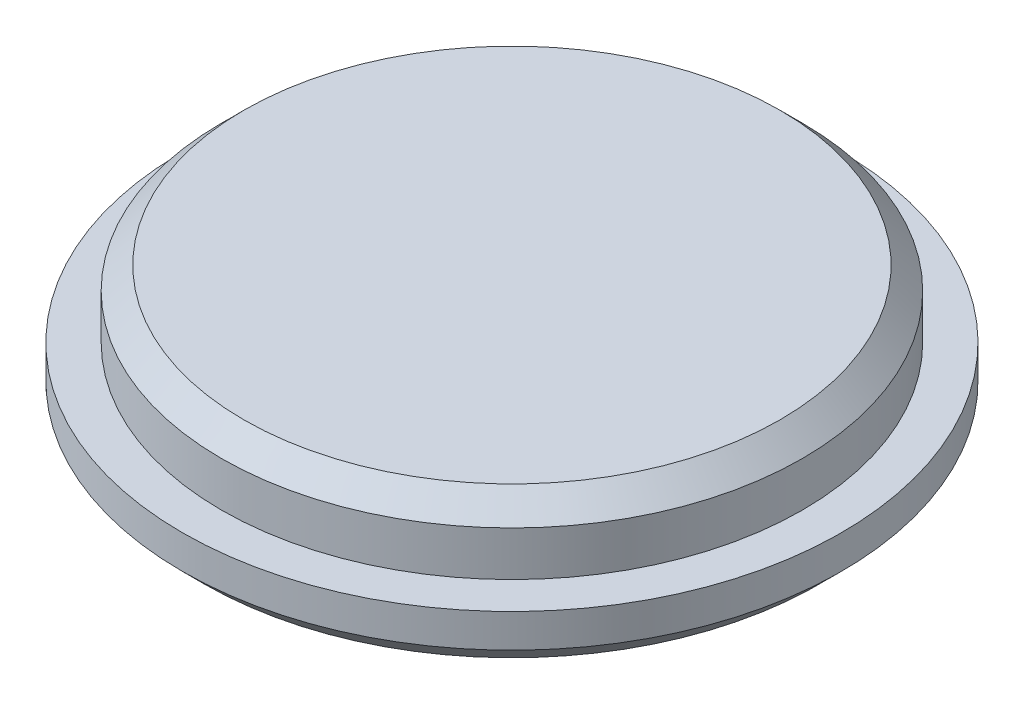
from build123d import *


with BuildPart() as part:
    # Sketch2 → Revolve1 (revolve)
    with BuildSketch(Plane.XY, mode=Mode.PRIVATE) as revolve1_sk:
        Polygon((0, 0), (27.5, 0), (29.5, 2), (29.5, 5), (26, 5), (26, 9), (24, 11), (0, 11), align=None)
    revolve(revolve1_sk.sketch.rotate(Axis((0, 0, 0), (0, -1, 0)), 90), axis=Axis((0, 0, 0), (0, -1, 0)))


solid = part.part
